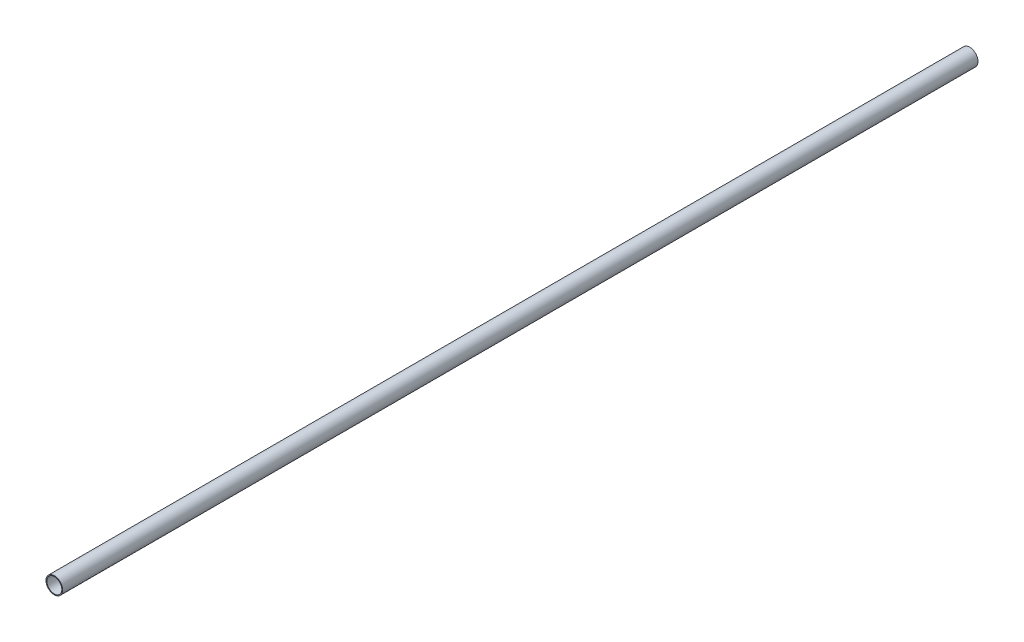
from build123d import *

# Parameters (mm, degrees)
SKETCH1_R           = 10
SKETCH1_R_2         = 9
BOSS_EXTRUDE1_DEPTH = 550


with BuildPart() as part:
    # Sketch1 → Boss-Extrude1 (new, symmetric)
    with BuildSketch(Plane.XY):
        Circle(SKETCH1_R)
        Circle(SKETCH1_R_2, mode=Mode.SUBTRACT)
    extrude(amount=BOSS_EXTRUDE1_DEPTH, both=True)


solid = part.part
